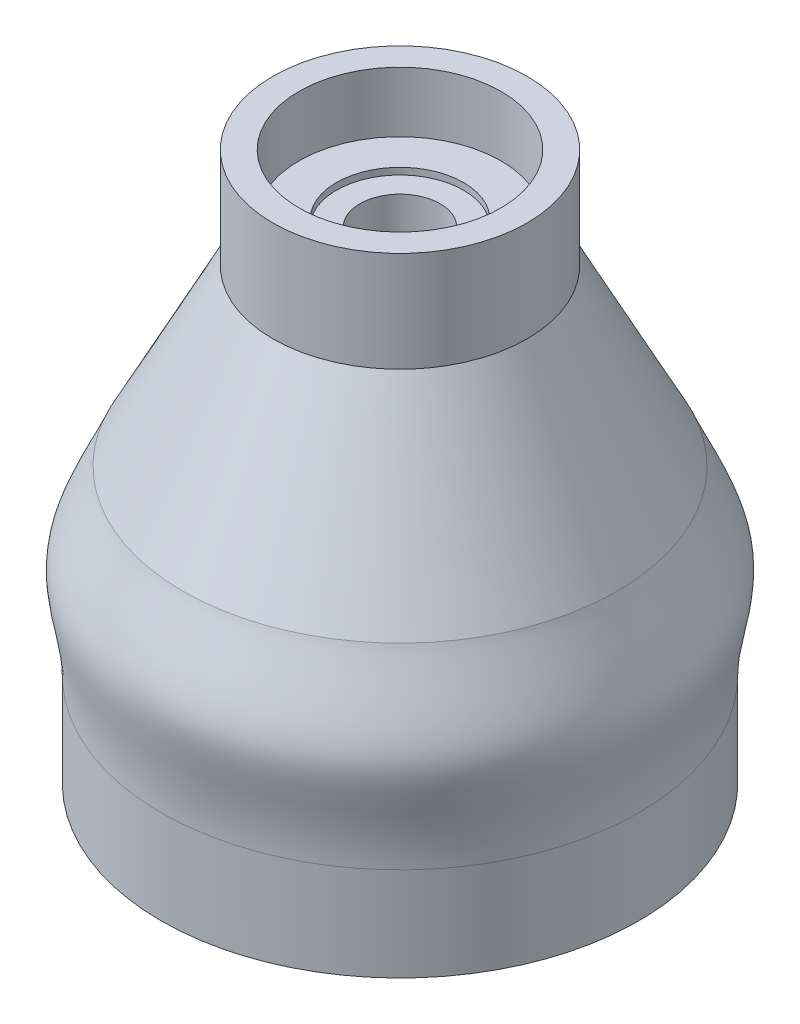
from build123d import *
from OCP.BRepFilletAPI import BRepFilletAPI_MakeChamfer

# Parameters (mm, degrees)
CHAMFER3_SIZE  = 1
CHAMFER3_SIZE2 = 1.732050808


with BuildPart() as part:
    # Sketch10 → Revolve1 (revolve)
    with BuildSketch(Plane(origin=(0, 0, 0), x_dir=(0, 0, -1), z_dir=(1, 0, 0)), mode=Mode.PRIVATE) as revolve1_sk:
        with BuildLine():
            Line((-6, 37), (-6, 73))
            Line((-6, 73), (-9.5, 73))
            Line((-9.5, 73), (-9.5, 74))
            Line((-9.5, 74), (-15.1, 74))
            Line((-15.1, 74), (-15.1, 83))
            Line((-15.1, 83), (-19, 83))
            Line((-19, 83), (-19, 68))
            Line((-19, 68), (-32.452427699, 42.060005436))
            add(Edge.make_bspline(
                [(-35.7, 15), (-35.7, 21.998470468), (-38.17114104, 26.621891379), (-36.358239491, 34.061117095), (-33.190750064, 40.03148141), (-32.452427699, 42.060005436)],
                knots=[0, 0, 0, 0, 0.519622211, 0.619622211, 1, 1, 1, 1], degree=3))
            Line((-35.7, 15), (-35.7, 0))
            Line((-35.7, 0), (-31.2, 0))
            Line((-31.2, 0), (-31.2, 27))
            Line((-31.2, 27), (-15.1, 27))
            Line((-15.1, 27), (-15.1, 36))
            Line((-15.1, 36), (-9.5, 36))
            Line((-9.5, 36), (-9.5, 37))
            Line((-9.5, 37), (-6, 37))
        make_face()
    revolve(revolve1_sk.sketch.rotate(Axis((0, 0, 0), (0, 1, 0)), 180), axis=Axis((0, 0, 0), (0, 1, 0)))

    # Chamfer3: one chamfer whose edges measure the first distance from different faces: ONE call of the kernel's chamfer builder (chamfer() names one face for all edges)
    chamfer3_edges_1 = [part.edges().sort_by_distance(p)[0] for p in [
        (0, 0, 35.7),
    ]]
    chamfer3_side_1 = [part.faces().sort_by_distance(p)[0] for p in [
        (0, 7.5, 35.7),
    ]]
    chamfer3_edges_2 = [part.edges().sort_by_distance(p)[0] for p in [
        (0, 0, 31.2),
    ]]
    chamfer3_side_2 = [part.faces().sort_by_distance(p)[0] for p in [
        (0, 0, 34.690251516),
    ]]
    chamfer3 = BRepFilletAPI_MakeChamfer(part.part.solid().wrapped)
    for e in chamfer3_edges_1:
        chamfer3.Add(CHAMFER3_SIZE, CHAMFER3_SIZE2, e.wrapped, chamfer3_side_1[0].wrapped)  # the first distance lies on this face
    for e in chamfer3_edges_2:
        chamfer3.Add(CHAMFER3_SIZE, CHAMFER3_SIZE2, e.wrapped, chamfer3_side_2[0].wrapped)  # the first distance lies on this face
    add(Compound.cast(chamfer3.Shape()), mode=Mode.REPLACE)


solid = part.part
